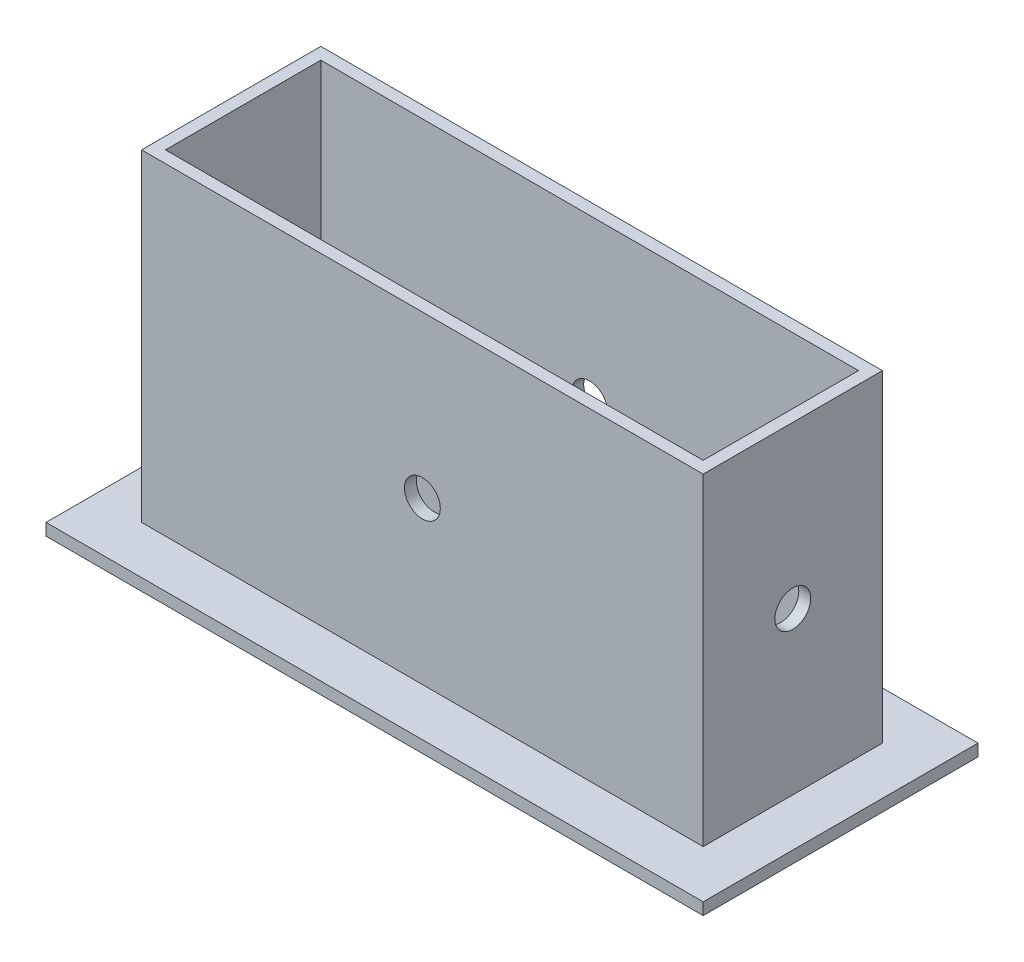
from build123d import *

# Parameters (mm, degrees)
SKETCH1_W           = 47
SKETCH1_H           = 27
BOSS_EXTRUDE1_DEPTH = 15
SKETCH2_W           = 45
SKETCH2_H           = 13
CUT_EXTRUDE1_DEPTH  = 27
SKETCH3_W           = 55
SKETCH3_H           = 23
SKETCH3_W_2         = 45
SKETCH3_H_2         = 13
BOSS_EXTRUDE2_DEPTH = 1
SKETCH4_R           = 1.5
CUT_EXTRUDE2_DEPTH  = 17
SKETCH5_R           = 1.5
CUT_EXTRUDE3_DEPTH  = 47


with BuildPart() as part:
    # Sketch1 → Boss-Extrude1 (new body)
    with BuildSketch(Plane.XY):
        Rectangle(SKETCH1_W, SKETCH1_H)
    extrude(amount=BOSS_EXTRUDE1_DEPTH)

    # Sketch2 → Cut-Extrude1 (cut)
    with BuildSketch(Plane(origin=(0, 13.5, 0), x_dir=(1, 0, 0), z_dir=(0, 1, 0))):
        with Locations((0, -7.5)):
            Rectangle(SKETCH2_W, SKETCH2_H)
    extrude(amount=-CUT_EXTRUDE1_DEPTH, mode=Mode.SUBTRACT)

    # Sketch3 → Boss-Extrude2 (add)
    with BuildSketch(Plane.XZ.offset(13.5)):
        with Locations((0, 7.5)):
            Rectangle(SKETCH3_W, SKETCH3_H)
        with Locations((0, 7.5)):
            Rectangle(SKETCH3_W_2, SKETCH3_H_2, mode=Mode.SUBTRACT)
    extrude(amount=BOSS_EXTRUDE2_DEPTH)

    # Sketch4 → Cut-Extrude2 (cut)
    with BuildSketch(Plane.XY.offset(15)):
        Circle(SKETCH4_R)
    extrude(amount=-CUT_EXTRUDE2_DEPTH, mode=Mode.SUBTRACT)

    # Sketch5 → Cut-Extrude3 (cut)
    with BuildSketch(Plane.ZY.offset(23.5)):
        with Locations(Location((7.5, 0, 0), (0, 0, 270))):
            Circle(SKETCH5_R)
    extrude(amount=-CUT_EXTRUDE3_DEPTH, mode=Mode.SUBTRACT)


solid = part.part
